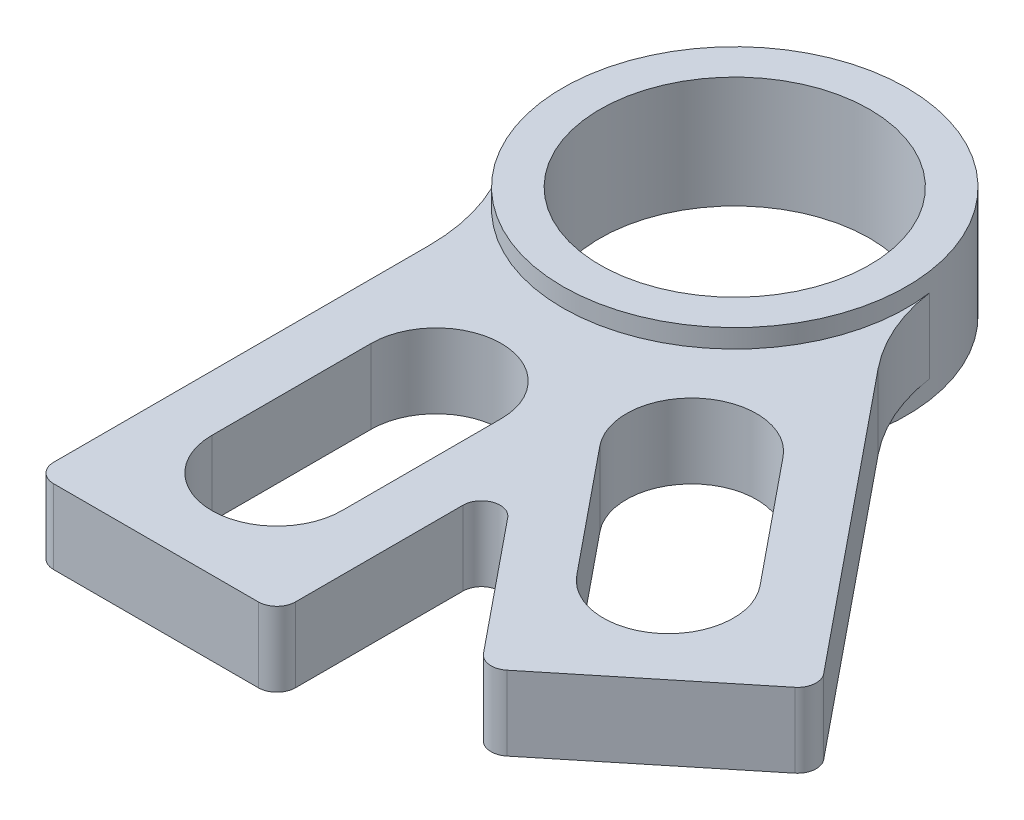
from build123d import *

# Parameters (mm, degrees)
SKETCH1_R                      = 14.6812
SKETCH1_R_2                    = 11.5062
BEARING_INSERT_EXTRUDE_DEPTH   = 4.7625
APEX_SLOT_INSERT_EXTRUDE_DEPTH = 3.175
FILLET1_R                      = 16.002
FILLET2_R                      = 1.5875


with BuildPart() as part:
    # Sketch1 → Bearing_Insert_Extrude (new, symmetric)
    with BuildSketch(Plane(origin=(0, 0, 0), x_dir=(1, 0, 0), z_dir=(0, 1, 0))):
        with Locations(Location((0, 0, 0), (0, 0, 90))):
            Circle(SKETCH1_R)
        with Locations(Location((0, 0, 0), (0, 0, 90))):
            Circle(SKETCH1_R_2, mode=Mode.SUBTRACT)
    extrude(amount=BEARING_INSERT_EXTRUDE_DEPTH, both=True)

    # Sketch1<4> → Apex_Slot_Insert_Extrude (add, symmetric)
    with BuildSketch(Plane(origin=(0, 0, 0), x_dir=(1, 0, 0), z_dir=(0, 1, 0))):
        with BuildLine():
            Line((-10.31875, -10.443228997), (-10.31875, -49.3903))
            Line((-10.31875, -49.3903), (10.31875, -49.3903))
            Line((10.31875, -49.3903), (10.31875, -29.044106442))
            Line((10.31875, -29.044106442), (23.155582838, -44.829647769))
            Line((23.155582838, -44.829647769), (39.16713351, -31.809023692))
            Line((39.16713351, -31.809023692), (14.594623738, -1.592040003))
            ThreePointArc((14.594623738, -1.592040003), (4.914942594, -13.834051205), (-10.31875, -10.443228997))
        make_face()
        with BuildLine():
            ThreePointArc((5.55625, -39.07155), (0, -44.6278), (-5.55625, -39.07155))
            Line((-5.55625, -39.07155), (-5.55625, -25.48255))
            ThreePointArc((-5.55625, -25.48255), (0, -19.9263), (5.55625, -25.48255))
            Line((5.55625, -25.48255), (5.55625, -39.07155))
        make_face(mode=Mode.SUBTRACT)
        with BuildLine():
            ThreePointArc((28.96184824, -26.808007759), (28.156598772, -34.624362499), (20.340244032, -33.819113031))
            Line((20.340244032, -33.819113031), (11.766663871, -23.276122742))
            ThreePointArc((11.766663871, -23.276122742), (12.571913339, -15.459768002), (20.388268079, -16.26501747))
            Line((20.388268079, -16.26501747), (28.96184824, -26.808007759))
        make_face(mode=Mode.SUBTRACT)
    extrude(amount=APEX_SLOT_INSERT_EXTRUDE_DEPTH, both=True)

    # Fillet1
    fillet1_edges = [part.edges().sort_by_distance(p)[0] for p in [
        (14.594623738, 0, 1.592040003),
        (-10.31875, 0, 10.443228997),
    ]]
    fillet(fillet1_edges, radius=FILLET1_R)

    # Fillet2
    fillet2_edges = [part.edges().sort_by_distance(p)[0] for p in [
        (-10.31875, 0, 49.3903),
        (10.31875, 0, 49.3903),
        (10.31875, 0, 29.044106442),
        (23.155582838, 0, 44.829647769),
        (39.16713351, 0, 31.809023692),
    ]]
    fillet(fillet2_edges, radius=FILLET2_R)


solid = part.part
